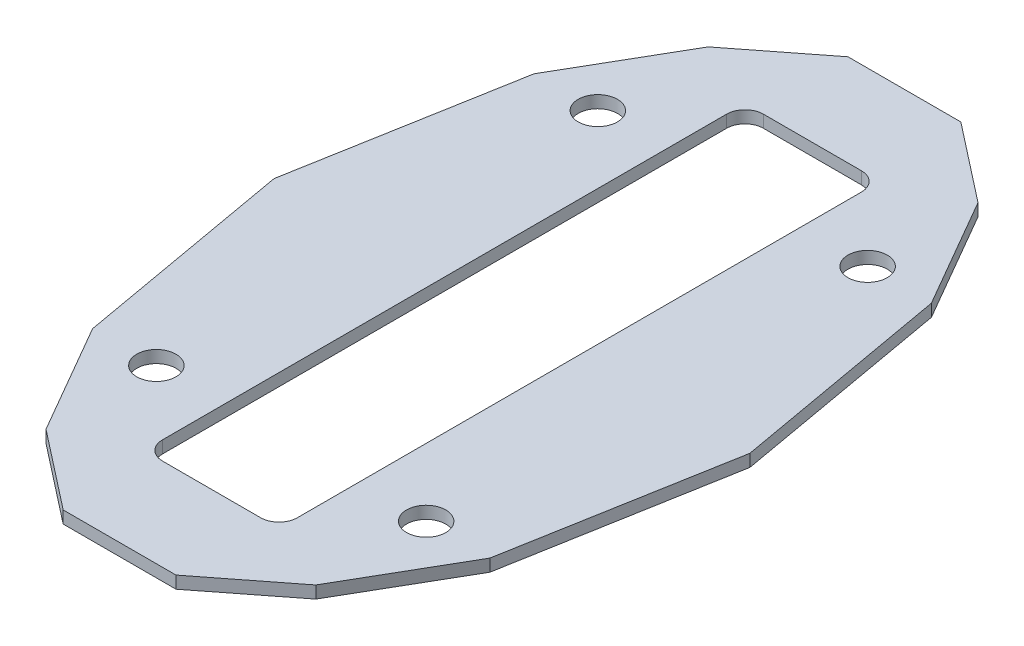
from build123d import *

# Parameters (mm, degrees)
BOSS_EXTRUDE1_DEPTH = 1
SKETCH2_W           = 11
SKETCH2_H           = 49
CUT_EXTRUDE1_DEPTH  = 38.434743221
FILLET1_R           = 1.5
SKETCH3_R           = 1.6
CUT_EXTRUDE2_DEPTH  = 38.434743221


with BuildPart() as part:
    # Sketch1 → Boss-Extrude1 (new body)
    with BuildSketch(Plane(origin=(0, 0, 0), x_dir=(1, 0, 0), z_dir=(0, 1, 0))):
        Polygon((19.4, 0), (16.2, 18), (11, 27), (4.6, 32), (-4.6, 32), (-11, 27), (-16.2, 18), (-19.4, 0), (-16.2, -18), (-11, -27), (-4.6, -32), (4.6, -32), (11, -27), (16.2, -18), align=None)
    extrude(amount=BOSS_EXTRUDE1_DEPTH)

    # Sketch2 → Cut-Extrude1 (cut, through all)
    with BuildSketch(Plane(origin=(0, 1, 0), x_dir=(1, 0, 0), z_dir=(0, 1, 0))):
        Rectangle(SKETCH2_W, SKETCH2_H)
    extrude(amount=-CUT_EXTRUDE1_DEPTH, mode=Mode.SUBTRACT)

    # Fillet1
    fillet1_edges = [part.edges().sort_by_distance(p)[0] for p in [
        (5.5, 0.5, -24.5),
        (5.5, 0.5, 24.5),
        (-5.5, 0.5, 24.5),
        (-5.5, 0.5, -24.5),
    ]]
    fillet(fillet1_edges, radius=FILLET1_R)

    # Sketch3 → Cut-Extrude2 (cut, through all)
    with BuildSketch(Plane(origin=(0, 1, 0), x_dir=(1, 0, 0), z_dir=(0, 1, 0))):
        with Locations(Location((-11, 18, 0), (0, 0, 270))):
            Circle(SKETCH3_R)
        with Locations(Location((11, 18, 0), (0, 0, 90))):
            Circle(SKETCH3_R)
        with Locations(Location((-11, -18, 0), (0, 0, 90))):
            Circle(SKETCH3_R)
        with Locations(Location((11, -18, 0), (0, 0, 270))):
            Circle(SKETCH3_R)
    extrude(amount=-CUT_EXTRUDE2_DEPTH, mode=Mode.SUBTRACT)


solid = part.part
